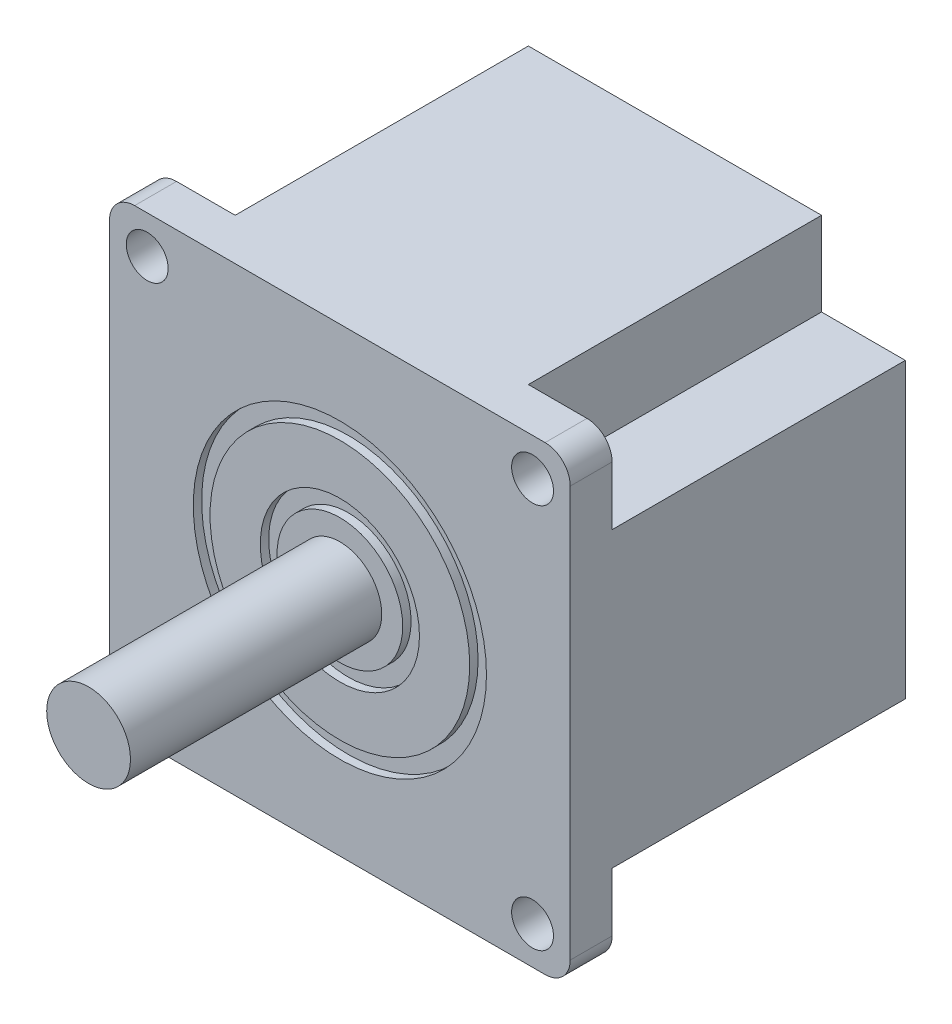
from build123d import *

# Parameters (mm, degrees)
BOSS_EXTRUDE1_DEPTH = 40
SKETCH3_R           = 2.5
BOSS_EXTRUDE2_DEPTH = 5
BOSS_EXTRUDE3_DEPTH = 30
SKETCH5_R           = 17.5
SKETCH5_R_2         = 15.5
SKETCH5_R_3         = 9.5
SKETCH5_R_4         = 7.5
CUT_EXTRUDE1_DEPTH  = 1


with BuildPart() as part:
    # Sketch1 → Boss-Extrude1 (new body)
    with BuildSketch(Plane.XY):
        Polygon((-27.5, -17.5), (-27.5, 17.5), (-17.5, 17.5), (-17.5, 27.5), (17.5, 27.5), (17.5, 17.5), (27.5, 17.5), (27.5, -17.5), (17.5, -17.5), (17.5, -27.5), (-17.5, -27.5), (-17.5, -17.5), align=None)
    extrude(amount=BOSS_EXTRUDE1_DEPTH)

    # Sketch3 → Boss-Extrude2 (add)
    # profile 1 of 5: a face of its own
    with BuildSketch(Plane.XY.offset(40)):
        Polygon((17.5, 27.5), (-17.5, 27.5), (-17.5, 17.5), (-27.5, 17.5), (-27.5, -17.5), (-17.5, -17.5), (-17.5, -27.5), (17.5, -27.5), (17.5, -17.5), (27.5, -17.5), (27.5, 17.5), (17.5, 17.5), align=None)
    # profile 2 of 5: a face of its own
    with BuildSketch(Plane.XY.offset(40)):
        with BuildLine():
            Line((24.5, 27.5), (17.5, 27.5))
            Line((17.5, 27.5), (17.5, 17.5))
            Line((17.5, 17.5), (27.5, 17.5))
            Line((27.5, 17.5), (27.5, 24.5))
            ThreePointArc((27.5, 24.5), (26.621320344, 26.621320344), (24.5, 27.5))
        make_face()
        with Locations((23, 23)):
            Circle(SKETCH3_R, mode=Mode.SUBTRACT)
    # profile 3 of 5: a face of its own
    with BuildSketch(Plane.XY.offset(40)):
        with BuildLine():
            Line((27.5, -24.5), (27.5, -17.5))
            Line((27.5, -17.5), (17.5, -17.5))
            Line((17.5, -17.5), (17.5, -27.5))
            Line((17.5, -27.5), (24.5, -27.5))
            ThreePointArc((24.5, -27.5), (26.621320344, -26.621320344), (27.5, -24.5))
        make_face()
        with Locations((23, -23)):
            Circle(SKETCH3_R, mode=Mode.SUBTRACT)
    # profile 4 of 5: a face of its own
    with BuildSketch(Plane.XY.offset(40)):
        with BuildLine():
            Line((-17.5, -17.5), (-27.5, -17.5))
            Line((-27.5, -17.5), (-27.5, -24.5))
            ThreePointArc((-27.5, -24.5), (-26.621320344, -26.621320344), (-24.5, -27.5))
            Line((-24.5, -27.5), (-17.5, -27.5))
            Line((-17.5, -27.5), (-17.5, -17.5))
        make_face()
        with Locations((-23, -23)):
            Circle(SKETCH3_R, mode=Mode.SUBTRACT)
    # profile 5 of 5: a face of its own
    with BuildSketch(Plane.XY.offset(40)):
        with BuildLine():
            Line((-17.5, 17.5), (-17.5, 27.5))
            Line((-17.5, 27.5), (-24.5, 27.5))
            ThreePointArc((-24.5, 27.5), (-26.621320344, 26.621320344), (-27.5, 24.5))
            Line((-27.5, 24.5), (-27.5, 17.5))
            Line((-27.5, 17.5), (-17.5, 17.5))
        make_face()
        with Locations((-23, 23)):
            Circle(SKETCH3_R, mode=Mode.SUBTRACT)
    extrude(amount=-BOSS_EXTRUDE2_DEPTH)

    # Sketch4 → Boss-Extrude3 (add)
    with BuildSketch(Plane.XY.offset(40)):
        with BuildLine():
            ThreePointArc((5, 0), (3.535533906, 3.535533906), (0, 5))
            Line((0, 5), (0, -5))
            ThreePointArc((0, -5), (3.535533906, -3.535533906), (5, 0))
        make_face()
        with BuildLine():
            Line((0, -5), (0, 5))
            ThreePointArc((0, 5), (-5, 0), (0, -5))
        make_face()
    extrude(amount=BOSS_EXTRUDE3_DEPTH)

    # Sketch5 → Cut-Extrude1 (cut)
    # profile 1 of 2: a face of its own
    with BuildSketch(Plane.XY.offset(40)):
        Circle(SKETCH5_R)
        Circle(SKETCH5_R_2, mode=Mode.SUBTRACT)
    # profile 2 of 2: a face of its own
    with BuildSketch(Plane.XY.offset(40)):
        Circle(SKETCH5_R_3)
        Circle(SKETCH5_R_4, mode=Mode.SUBTRACT)
    extrude(amount=-CUT_EXTRUDE1_DEPTH, mode=Mode.SUBTRACT)


solid = part.part
